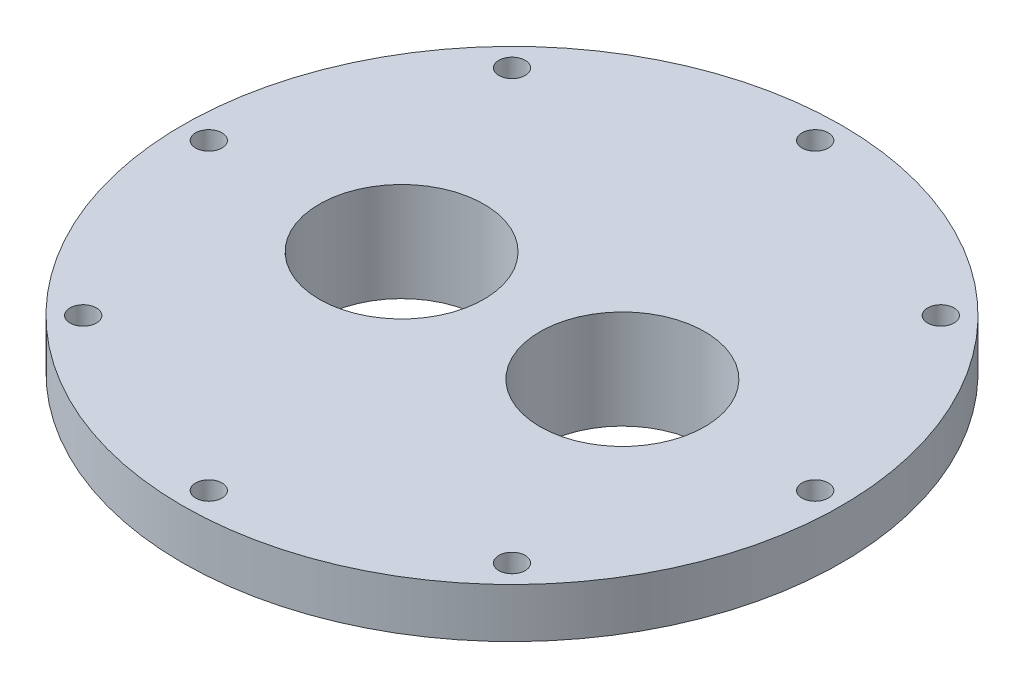
from build123d import *

# Parameters (mm, degrees)
SKETCH1_R           = 67
SKETCH1_R_2         = 25
BOSS_EXTRUDE1_DEPTH = 15
SKETCH2_R           = 100
SKETCH2_R_2         = 25
BOSS_EXTRUDE2_DEPTH = 15
SKETCH4_R           = 4
CUT_EXTRUDE2_DEPTH  = 15
CIRPATTERN1_COUNT   = 8


with BuildPart() as part:
    # Sketch1 → Boss-Extrude1 (new body)
    with BuildSketch(Plane(origin=(0, 0, 0), x_dir=(1, 0, 0), z_dir=(0, 1, 0))):
        with Locations(Location((0, 0, 0), (0, 0, 270))):
            Circle(SKETCH1_R)
        with Locations(Location((-33.5, 0, 0), (0, 0, 270))):
            Circle(SKETCH1_R_2, mode=Mode.SUBTRACT)
        with Locations(Location((33.5, 0, 0), (0, 0, 270))):
            Circle(SKETCH1_R_2, mode=Mode.SUBTRACT)
    extrude(amount=BOSS_EXTRUDE1_DEPTH)

    # Sketch2 → Boss-Extrude2 (add)
    with BuildSketch(Plane(origin=(0, 15, 0), x_dir=(1, 0, 0), z_dir=(0, 1, 0))):
        with Locations(Location((0, 0, 0), (0, 0, 270))):
            Circle(SKETCH2_R)
        with Locations(Location((33.5, 0, 0), (0, 0, 270))):
            Circle(SKETCH2_R_2, mode=Mode.SUBTRACT)
        with Locations(Location((-33.5, 0, 0), (0, 0, 270))):
            Circle(SKETCH2_R_2, mode=Mode.SUBTRACT)
    extrude(amount=BOSS_EXTRUDE2_DEPTH)

    # Sketch4 → Cut-Extrude2 (cut)
    with BuildSketch(Plane(origin=(0, 30, 0), x_dir=(1, 0, 0), z_dir=(0, 1, 0))):
        with Locations(Location((-92, 0, 0), (0, 0, 270))):
            Circle(SKETCH4_R)
    cut_extrude2 = extrude(amount=-CUT_EXTRUDE2_DEPTH, mode=Mode.SUBTRACT)

    # CirPattern1: Cut-Extrude2 ×8 about axis
    cirpattern1_axis = Axis((0, 0, 0), (0, 1, 0))
    for i in range(1, CIRPATTERN1_COUNT):
        add(cut_extrude2.rotate(cirpattern1_axis, i * 360 / CIRPATTERN1_COUNT), mode=Mode.SUBTRACT)


solid = part.part
